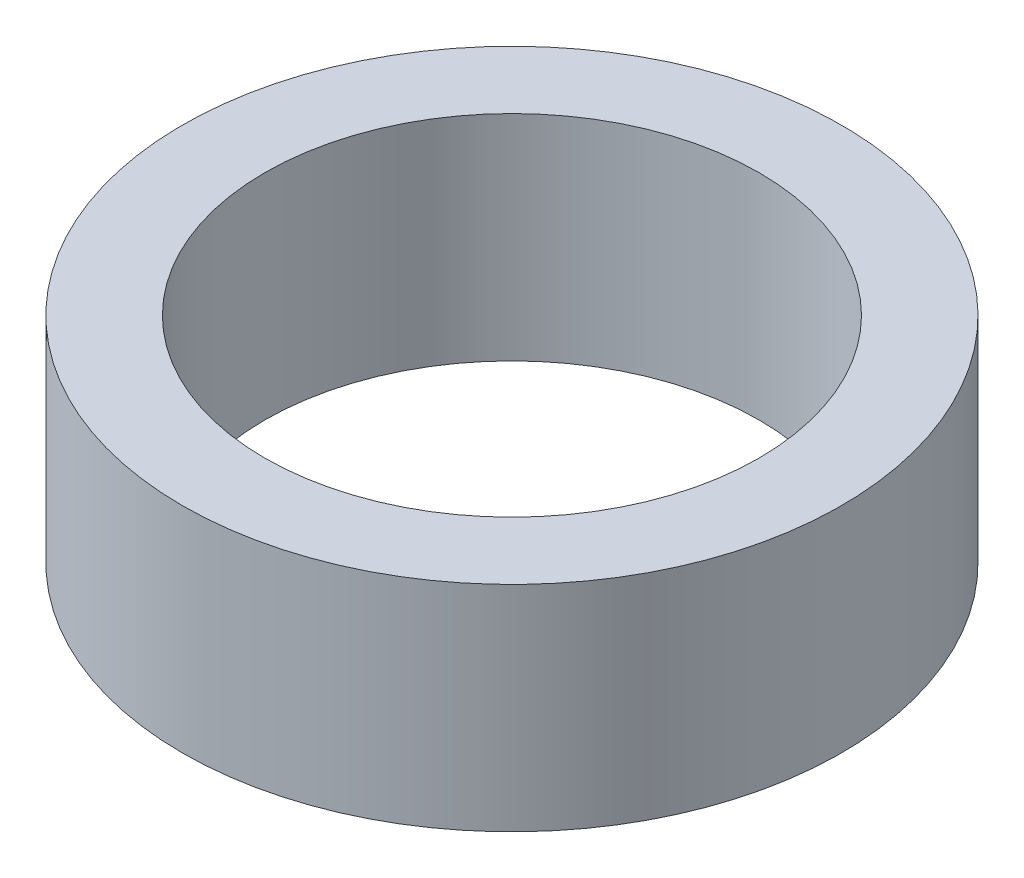
from build123d import *

# Parameters (mm, degrees)
SKETCH1_R           = 2
SKETCH1_R_2         = 1.5
BOSS_EXTRUDE1_DEPTH = 1.3


with BuildPart() as part:
    # Sketch1 → Boss-Extrude1 (new body)
    with BuildSketch(Plane(origin=(0, 0, 0), x_dir=(1, 0, 0), z_dir=(0, 1, 0))):
        with Locations(Location((0, 0, 0), (0, 0, 270))):
            Circle(SKETCH1_R)
        with Locations(Location((0, 0, 0), (0, 0, 270))):
            Circle(SKETCH1_R_2, mode=Mode.SUBTRACT)
    extrude(amount=BOSS_EXTRUDE1_DEPTH)


solid = part.part
